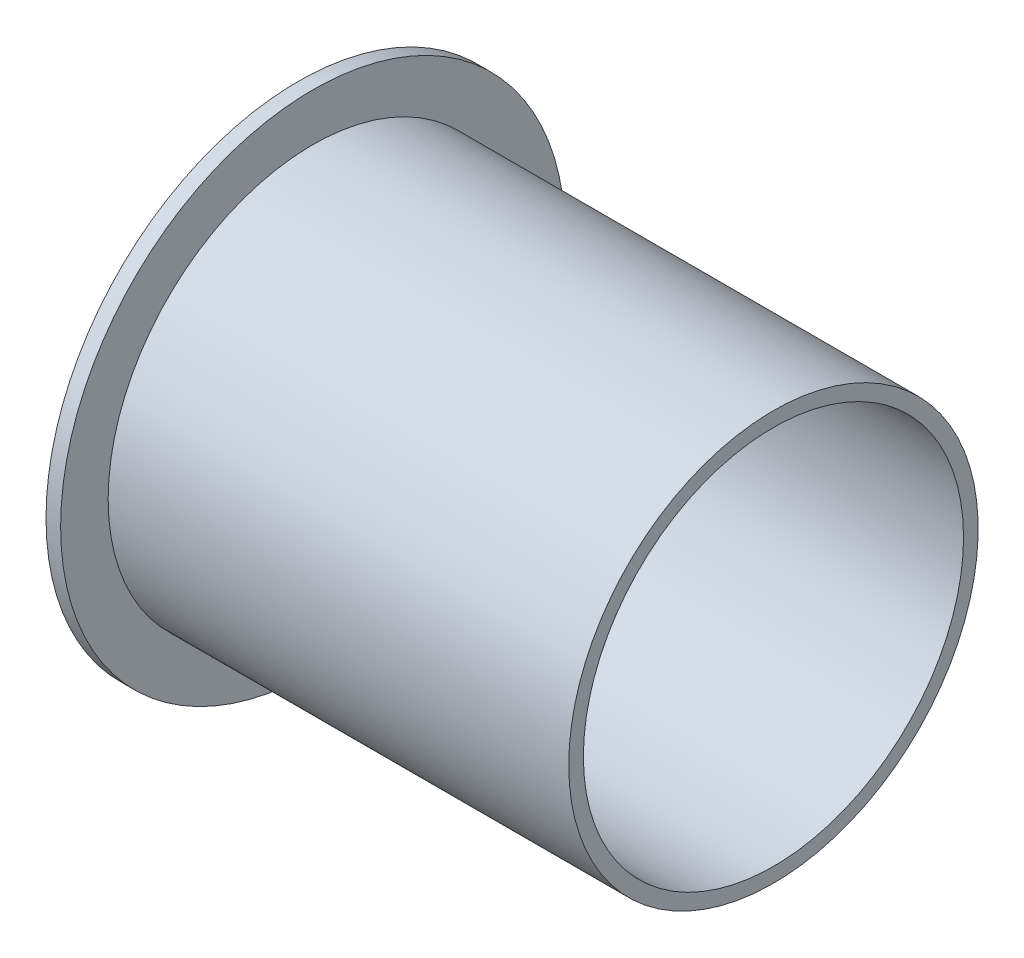
from build123d import *


with BuildPart() as part:
    # Sketch1 → Revolve1 (revolve)
    with BuildSketch(Plane(origin=(0, 0, 0), x_dir=(1, 0, 0), z_dir=(0, 1, 0)), mode=Mode.PRIVATE) as revolve1_sk:
        Polygon((0, 34.5), (0, 26), (65, 26), (65, 28), (2, 28), (2, 34.5), align=None)
    revolve(revolve1_sk.sketch.rotate(Axis((-54.305436705, 0, 0), (1, 0, 0)), 180), axis=Axis((-54.305436705, 0, 0), (1, 0, 0)))


solid = part.part
